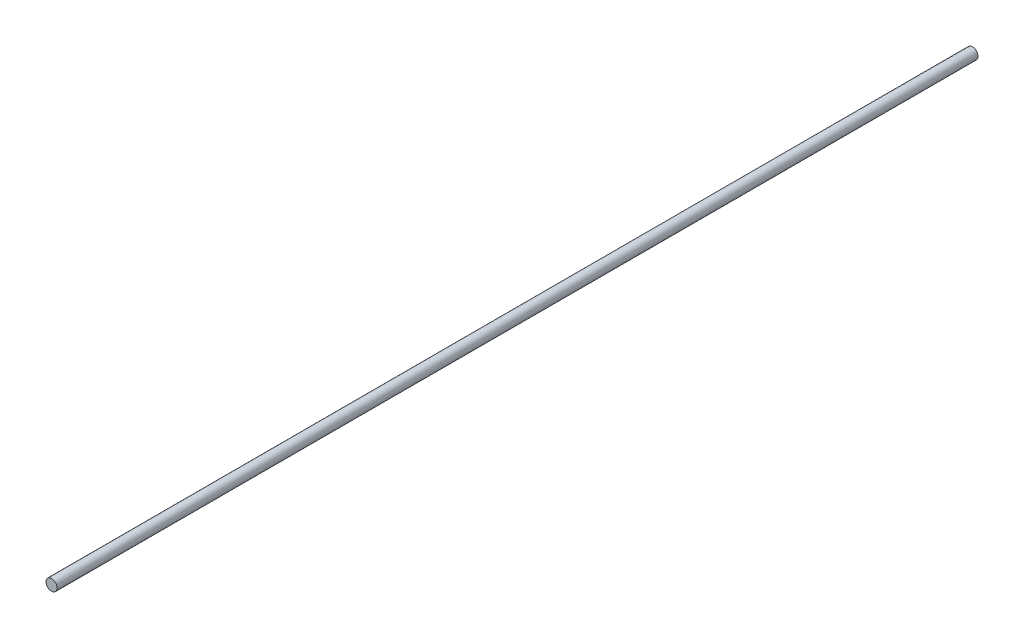
from build123d import *

# Parameters (mm, degrees)
SKETCH1_R           = 9.779
BOSS_EXTRUDE1_DEPTH = 1625


with BuildPart() as part:
    # Sketch1 → Boss-Extrude1 (new body)
    with BuildSketch(Plane.XY):
        Circle(SKETCH1_R)
    extrude(amount=BOSS_EXTRUDE1_DEPTH)


solid = part.part
